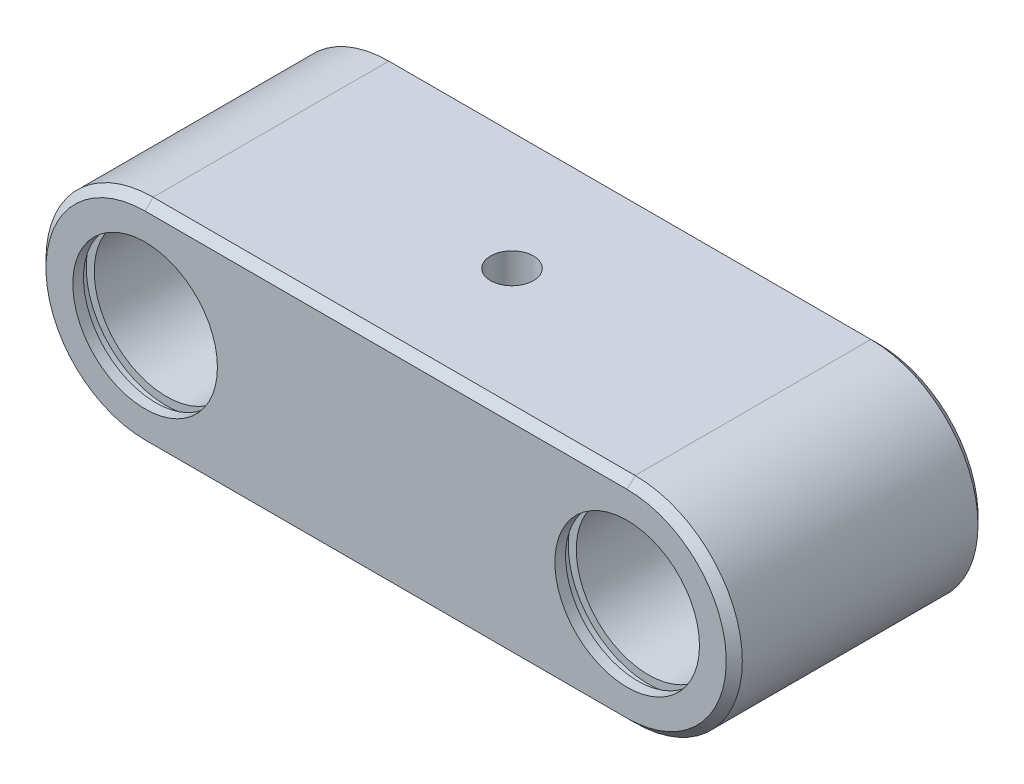
from build123d import *

# Parameters (mm, degrees)
BOSS_EXTRUDE1_START = 650
SKETCH1_R           = 13.5
BOSS_EXTRUDE1_DEPTH = 47
CUT_EXTRUDE2_START  = -2
SKETCH4_R           = 15
SKETCH4_R_2         = 13.5
CUT_EXTRUDE2_DEPTH  = 2
SKETCH5_R           = 4
CUT_EXTRUDE3_DEPTH  = 40
CUT_EXTRUDE4_START  = -4
SKETCH6_R           = 15
SKETCH6_R_2         = 13.5
CUT_EXTRUDE4_DEPTH  = 2
CHAMFER1_SIZE       = 1.5


with BuildPart() as part:
    # Sketch1 → Boss-Extrude1 (new body)
    with BuildSketch(Plane.XY.offset(BOSS_EXTRUDE1_START)):
        with BuildLine():
            Line((-45, 20), (45, 20))
            ThreePointArc((45, 20), (65, 0), (45, -20))
            Line((45, -20), (-45, -20))
            ThreePointArc((-45, -20), (-65, 0), (-45, 20))
        make_face()
        with Locations((-45, 0)):
            Circle(SKETCH1_R, mode=Mode.SUBTRACT)
        with Locations((45, 0)):
            Circle(SKETCH1_R, mode=Mode.SUBTRACT)
    extrude(amount=-BOSS_EXTRUDE1_DEPTH)

    # Sketch4 → Cut-Extrude2 (cut)
    # profile 1 of 2: a face of its own
    with BuildSketch(Plane.XY.offset(650).offset(CUT_EXTRUDE2_START)):
        with Locations((-45, 0)):
            Circle(SKETCH4_R)
        with Locations((-45, 0)):
            Circle(SKETCH4_R_2, mode=Mode.SUBTRACT)
    # profile 2 of 2: a face of its own
    with BuildSketch(Plane.XY.offset(650).offset(CUT_EXTRUDE2_START)):
        with Locations((45, 0)):
            Circle(SKETCH4_R)
        with Locations((45, 0)):
            Circle(SKETCH4_R_2, mode=Mode.SUBTRACT)
    extrude(amount=-CUT_EXTRUDE2_DEPTH, mode=Mode.SUBTRACT)

    # Sketch5 → Cut-Extrude3 (cut)
    with BuildSketch(Plane(origin=(0, 20, 0), x_dir=(1, 0, 0), z_dir=(0, 1, 0))):
        with Locations(Location((0, -626.5, 0), (0, 0, 270))):
            Circle(SKETCH5_R)
    extrude(amount=-CUT_EXTRUDE3_DEPTH, mode=Mode.SUBTRACT)

    # Sketch6 → Cut-Extrude4 (cut)
    # profile 1 of 2: a face of its own
    with BuildSketch(Plane(origin=(0, 0, 603), x_dir=(-1, 0, 0), z_dir=(0, 0, -1)).offset(CUT_EXTRUDE4_START)):
        with Locations(Location((-45, 0, 0), (0, 0, 180))):
            Circle(SKETCH6_R)
        with Locations(Location((-45, 0, 0), (0, 0, 180))):
            Circle(SKETCH6_R_2, mode=Mode.SUBTRACT)
    # profile 2 of 2: a face of its own
    with BuildSketch(Plane(origin=(0, 0, 603), x_dir=(-1, 0, 0), z_dir=(0, 0, -1)).offset(CUT_EXTRUDE4_START)):
        with Locations(Location((45, 0, 0), (0, 0, 180))):
            Circle(SKETCH6_R)
        with Locations(Location((45, 0, 0), (0, 0, 180))):
            Circle(SKETCH6_R_2, mode=Mode.SUBTRACT)
    extrude(amount=CUT_EXTRUDE4_DEPTH, mode=Mode.SUBTRACT)

    # Chamfer1
    chamfer1_edges = [part.edges().sort_by_distance(p)[0] for p in [
        (65, 0, 603),
        (0, 20, 603),
        (-65, 0, 603),
        (0, 20, 650),
        (65, 0, 650),
        (0, -20, 650),
        (-65, 0, 650),
        (0, -20, 603),
    ]]
    chamfer(chamfer1_edges, length=CHAMFER1_SIZE)


solid = part.part
